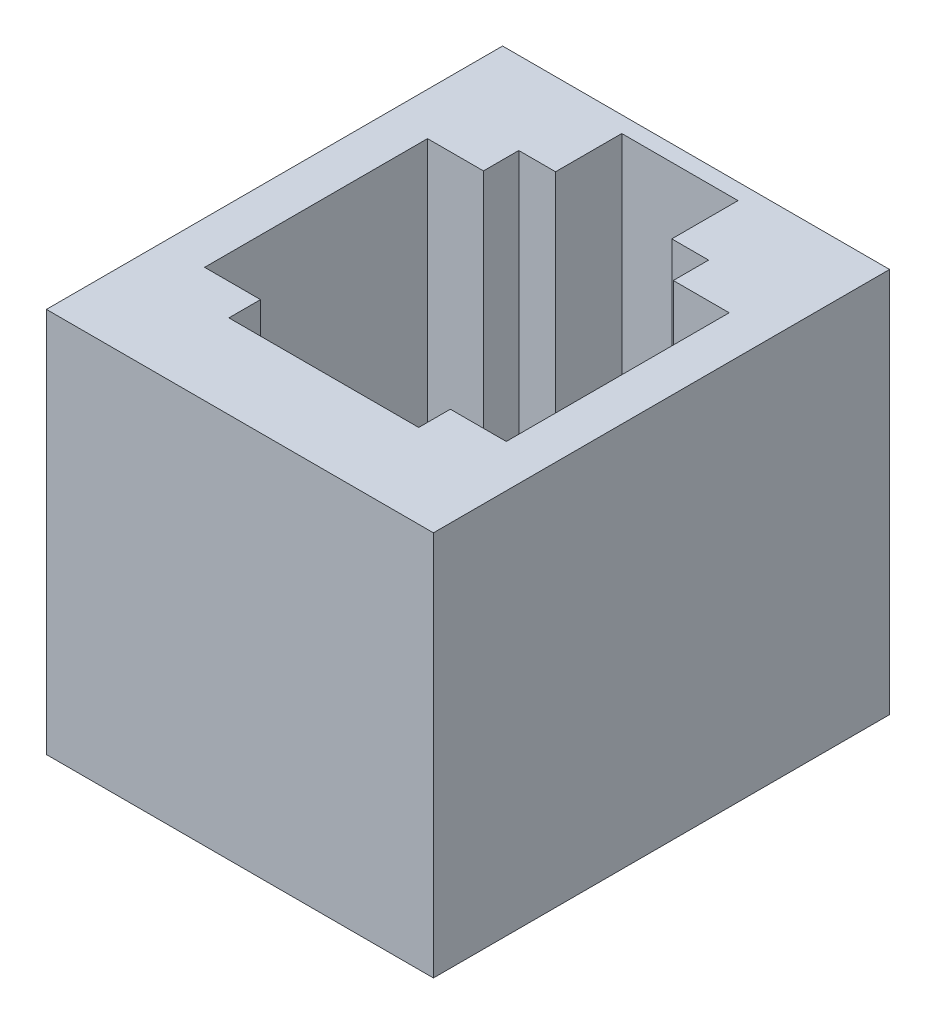
from build123d import *

# Parameters (mm, degrees)
SKETCH1_W                       = 13.3604
SKETCH1_H                       = 15.748
BOSS_EXTRUDE1_DEPTH             = 13.3096
CUT_EXTRUDE1_DEPTH              = 6.731
CUT_EXTRUDE2_DEPTH              = 6.4516
SKETCH4_W                       = 0.254
SKETCH4_H                       = 1.0922
CUT_EXTRUDE3_DEPTH              = 6.4516
BOSS_EXTRUDE2_REACH             = 17.835
BOSS_EXTRUDE2_DIRECTION_2_REACH = 17.835
CUT_EXTRUDE4_REACH              = 18.845
SKETCH6_W                       = 0.254
SKETCH6_H                       = 6.0452


with BuildPart() as part:
    # Sketch1 → Boss-Extrude1 (new body)
    with BuildSketch(Plane(origin=(0, 0, 0), x_dir=(1, 0, 0), z_dir=(0, 1, 0))):
        Rectangle(SKETCH1_W, SKETCH1_H)
    extrude(amount=BOSS_EXTRUDE1_DEPTH)

    # Sketch2 → Cut-Extrude1 (cut)
    with BuildSketch(Plane(origin=(0, 13.3096, 0), x_dir=(1, 0, 0), z_dir=(0, 1, 0))):
        Polygon((-2.0066, 7.3152), (-2.0066, 5.0292), (-3.2766, 5.0292), (-3.2766, 3.81), (-5.207, 3.81), (-5.207, -3.8862), (-3.2766, -3.8862), (-3.2766, -4.9784), (3.2766, -4.9784), (3.2766, -3.8862), (5.207, -3.8862), (5.207, 3.81), (3.2766, 3.81), (3.2766, 5.0292), (2.0066, 5.0292), (2.0066, 7.3152), align=None)
    extrude(amount=-CUT_EXTRUDE1_DEPTH, mode=Mode.SUBTRACT)

    # Sketch3 → Cut-Extrude2 (cut)
    with BuildSketch(Plane(origin=(0, 6.5786, 0), x_dir=(1, 0, 0), z_dir=(0, 1, 0))):
        Polygon((-3.2766, -3.8862), (3.2766, -3.8862), (5.207, -3.8862), (5.207, 3.81), (3.2766, 3.81), (3.2766, 5.0292), (2.0066, 5.0292), (2.0066, 7.3152), (-2.0066, 7.3152), (-2.0066, 5.0292), (-3.2766, 5.0292), (-3.2766, 3.81), (-5.207, 3.81), (-5.207, -3.8862), align=None)
    extrude(amount=-CUT_EXTRUDE2_DEPTH, mode=Mode.SUBTRACT)

    # Sketch4 → Cut-Extrude3 (cut)
    with BuildSketch(Plane(origin=(0, 6.5786, 0), x_dir=(1, 0, 0), z_dir=(0, 1, 0))):
        with Locations((-0.9525, -4.4323)):
            Rectangle(SKETCH4_W, SKETCH4_H)
        with Locations((-0.3175, -4.4323)):
            Rectangle(SKETCH4_W, SKETCH4_H)
        with Locations((0.3175, -4.4323)):
            Rectangle(SKETCH4_W, SKETCH4_H)
        with Locations((0.9525, -4.4323)):
            Rectangle(SKETCH4_W, SKETCH4_H)
    extrude(amount=-CUT_EXTRUDE3_DEPTH, mode=Mode.SUBTRACT)

    # Sketch5 → Boss-Extrude2 (add, up to next)
    with BuildSketch(Plane(origin=(0, 1.788865417, 0.693855168), x_dir=(-1, 0, 0), z_dir=(0, -0.9323238012155132, -0.3616245700820899)), mode=Mode.PRIVATE) as boss_extrude2_sk1:
        with BuildLine():
            Line((1.0795, -4.595554492), (0.8255, -4.595554492))
            Line((0.8255, -4.595554492), (0.8255, -2.389497415))
            ThreePointArc((0.8255, -2.389497415), (0.9525, -2.262497415), (1.0795, -2.389497415))
            Line((1.0795, -2.389497415), (1.0795, -4.595554492))
        make_face()
    boss_extrude2_tool1 = extrude(boss_extrude2_sk1.sketch, amount=BOSS_EXTRUDE2_REACH, mode=Mode.PRIVATE) - part.part
    # Sketch5 → Boss-Extrude2 (add, up to next)
    with BuildSketch(Plane(origin=(0, 1.788865417, 0.693855168), x_dir=(-1, 0, 0), z_dir=(0, -0.9323238012155132, -0.3616245700820899)), mode=Mode.PRIVATE) as boss_extrude2_sk2:
        with BuildLine():
            Line((0.4445, -4.595554492), (0.1905, -4.595554492))
            Line((0.1905, -4.595554492), (0.1905, -2.389497415))
            ThreePointArc((0.1905, -2.389497415), (0.3175, -2.262497415), (0.4445, -2.389497415))
            Line((0.4445, -2.389497415), (0.4445, -4.595554492))
        make_face()
    boss_extrude2_tool2 = extrude(boss_extrude2_sk2.sketch, amount=BOSS_EXTRUDE2_REACH, mode=Mode.PRIVATE) - part.part
    # Sketch5 → Boss-Extrude2 (add, up to next)
    with BuildSketch(Plane(origin=(0, 1.788865417, 0.693855168), x_dir=(-1, 0, 0), z_dir=(0, -0.9323238012155132, -0.3616245700820899)), mode=Mode.PRIVATE) as boss_extrude2_sk3:
        with BuildLine():
            Line((-0.1905, -4.595554492), (-0.4445, -4.595554492))
            Line((-0.4445, -4.595554492), (-0.4445, -2.389497415))
            ThreePointArc((-0.4445, -2.389497415), (-0.3175, -2.262497415), (-0.1905, -2.389497415))
            Line((-0.1905, -2.389497415), (-0.1905, -4.595554492))
        make_face()
    boss_extrude2_tool3 = extrude(boss_extrude2_sk3.sketch, amount=BOSS_EXTRUDE2_REACH, mode=Mode.PRIVATE) - part.part
    # Sketch5 → Boss-Extrude2 (add, up to next)
    with BuildSketch(Plane(origin=(0, 1.788865417, 0.693855168), x_dir=(-1, 0, 0), z_dir=(0, -0.9323238012155132, -0.3616245700820899)), mode=Mode.PRIVATE) as boss_extrude2_sk4:
        with BuildLine():
            Line((-0.8255, -4.595554492), (-1.0795, -4.595554492))
            Line((-1.0795, -4.595554492), (-1.0795, -2.389497415))
            ThreePointArc((-1.0795, -2.389497415), (-0.9525, -2.262497415), (-0.8255, -2.389497415))
            Line((-0.8255, -2.389497415), (-0.8255, -4.595554492))
        make_face()
    boss_extrude2_tool4 = extrude(boss_extrude2_sk4.sketch, amount=BOSS_EXTRUDE2_REACH, mode=Mode.PRIVATE) - part.part
    add(boss_extrude2_tool1.solids().sort_by_distance((-0.9525, 0.54398, 3.90336))[0])
    add(boss_extrude2_tool2.solids().sort_by_distance((-0.3175, 0.54398, 3.90336))[0])
    add(boss_extrude2_tool3.solids().sort_by_distance((0.3175, 0.54398, 3.90336))[0])
    add(boss_extrude2_tool4.solids().sort_by_distance((0.9525, 0.54398, 3.90336))[0])

    # Sketch5 → Boss-Extrude2 direction 2 (add, up to next)
    with BuildSketch(Plane(origin=(0, 1.788865417, 0.693855168), x_dir=(-1, 0, 0), z_dir=(0, -0.9323238012155132, -0.3616245700820899)), mode=Mode.PRIVATE) as boss_extrude2_direction_2_sk1:
        with BuildLine():
            Line((1.0795, -4.595554492), (0.8255, -4.595554492))
            Line((0.8255, -4.595554492), (0.8255, -2.389497415))
            ThreePointArc((0.8255, -2.389497415), (0.9525, -2.262497415), (1.0795, -2.389497415))
            Line((1.0795, -2.389497415), (1.0795, -4.595554492))
        make_face()
    boss_extrude2_direction_2_tool1 = extrude(boss_extrude2_direction_2_sk1.sketch, amount=-BOSS_EXTRUDE2_DIRECTION_2_REACH, mode=Mode.PRIVATE) - part.part
    # Sketch5 → Boss-Extrude2 direction 2 (add, up to next)
    with BuildSketch(Plane(origin=(0, 1.788865417, 0.693855168), x_dir=(-1, 0, 0), z_dir=(0, -0.9323238012155132, -0.3616245700820899)), mode=Mode.PRIVATE) as boss_extrude2_direction_2_sk2:
        with BuildLine():
            Line((0.4445, -4.595554492), (0.1905, -4.595554492))
            Line((0.1905, -4.595554492), (0.1905, -2.389497415))
            ThreePointArc((0.1905, -2.389497415), (0.3175, -2.262497415), (0.4445, -2.389497415))
            Line((0.4445, -2.389497415), (0.4445, -4.595554492))
        make_face()
    boss_extrude2_direction_2_tool2 = extrude(boss_extrude2_direction_2_sk2.sketch, amount=-BOSS_EXTRUDE2_DIRECTION_2_REACH, mode=Mode.PRIVATE) - part.part
    # Sketch5 → Boss-Extrude2 direction 2 (add, up to next)
    with BuildSketch(Plane(origin=(0, 1.788865417, 0.693855168), x_dir=(-1, 0, 0), z_dir=(0, -0.9323238012155132, -0.3616245700820899)), mode=Mode.PRIVATE) as boss_extrude2_direction_2_sk3:
        with BuildLine():
            Line((-0.1905, -4.595554492), (-0.4445, -4.595554492))
            Line((-0.4445, -4.595554492), (-0.4445, -2.389497415))
            ThreePointArc((-0.4445, -2.389497415), (-0.3175, -2.262497415), (-0.1905, -2.389497415))
            Line((-0.1905, -2.389497415), (-0.1905, -4.595554492))
        make_face()
    boss_extrude2_direction_2_tool3 = extrude(boss_extrude2_direction_2_sk3.sketch, amount=-BOSS_EXTRUDE2_DIRECTION_2_REACH, mode=Mode.PRIVATE) - part.part
    # Sketch5 → Boss-Extrude2 direction 2 (add, up to next)
    with BuildSketch(Plane(origin=(0, 1.788865417, 0.693855168), x_dir=(-1, 0, 0), z_dir=(0, -0.9323238012155132, -0.3616245700820899)), mode=Mode.PRIVATE) as boss_extrude2_direction_2_sk4:
        with BuildLine():
            Line((-0.8255, -4.595554492), (-1.0795, -4.595554492))
            Line((-1.0795, -4.595554492), (-1.0795, -2.389497415))
            ThreePointArc((-1.0795, -2.389497415), (-0.9525, -2.262497415), (-0.8255, -2.389497415))
            Line((-0.8255, -2.389497415), (-0.8255, -4.595554492))
        make_face()
    boss_extrude2_direction_2_tool4 = extrude(boss_extrude2_direction_2_sk4.sketch, amount=-BOSS_EXTRUDE2_DIRECTION_2_REACH, mode=Mode.PRIVATE) - part.part
    add(boss_extrude2_direction_2_tool1.solids().sort_by_distance((-0.9525, 0.54398, 3.90336))[0])
    add(boss_extrude2_direction_2_tool2.solids().sort_by_distance((-0.3175, 0.54398, 3.90336))[0])
    add(boss_extrude2_direction_2_tool3.solids().sort_by_distance((0.3175, 0.54398, 3.90336))[0])
    add(boss_extrude2_direction_2_tool4.solids().sort_by_distance((0.9525, 0.54398, 3.90336))[0])

    # Sketch6 → Cut-Extrude4 (cut, up to next)
    with BuildSketch(Plane.XZ, mode=Mode.PRIVATE) as cut_extrude4_sk1:
        with Locations((-0.9525, -0.4826)):
            Rectangle(SKETCH6_W, SKETCH6_H)
    cut_extrude4_tool1 = extrude(cut_extrude4_sk1.sketch, amount=-CUT_EXTRUDE4_REACH, mode=Mode.PRIVATE) & part.part
    # Sketch6 → Cut-Extrude4 (cut, up to next)
    with BuildSketch(Plane.XZ, mode=Mode.PRIVATE) as cut_extrude4_sk2:
        with Locations((-0.3175, -0.4826)):
            Rectangle(SKETCH6_W, SKETCH6_H)
    cut_extrude4_tool2 = extrude(cut_extrude4_sk2.sketch, amount=-CUT_EXTRUDE4_REACH, mode=Mode.PRIVATE) & part.part
    # Sketch6 → Cut-Extrude4 (cut, up to next)
    with BuildSketch(Plane.XZ, mode=Mode.PRIVATE) as cut_extrude4_sk3:
        with Locations((0.9525, -0.4826)):
            Rectangle(SKETCH6_W, SKETCH6_H)
    cut_extrude4_tool3 = extrude(cut_extrude4_sk3.sketch, amount=-CUT_EXTRUDE4_REACH, mode=Mode.PRIVATE) & part.part
    # Sketch6 → Cut-Extrude4 (cut, up to next)
    with BuildSketch(Plane.XZ, mode=Mode.PRIVATE) as cut_extrude4_sk4:
        with Locations((0.3175, -0.4826)):
            Rectangle(SKETCH6_W, SKETCH6_H)
    cut_extrude4_tool4 = extrude(cut_extrude4_sk4.sketch, amount=-CUT_EXTRUDE4_REACH, mode=Mode.PRIVATE) & part.part
    add(cut_extrude4_tool1.solids().sort_by_distance((-0.9525, 0, -0.4826))[0], mode=Mode.SUBTRACT)
    add(cut_extrude4_tool2.solids().sort_by_distance((-0.3175, 0, -0.4826))[0], mode=Mode.SUBTRACT)
    add(cut_extrude4_tool3.solids().sort_by_distance((0.9525, 0, -0.4826))[0], mode=Mode.SUBTRACT)
    add(cut_extrude4_tool4.solids().sort_by_distance((0.3175, 0, -0.4826))[0], mode=Mode.SUBTRACT)


solid = part.part
